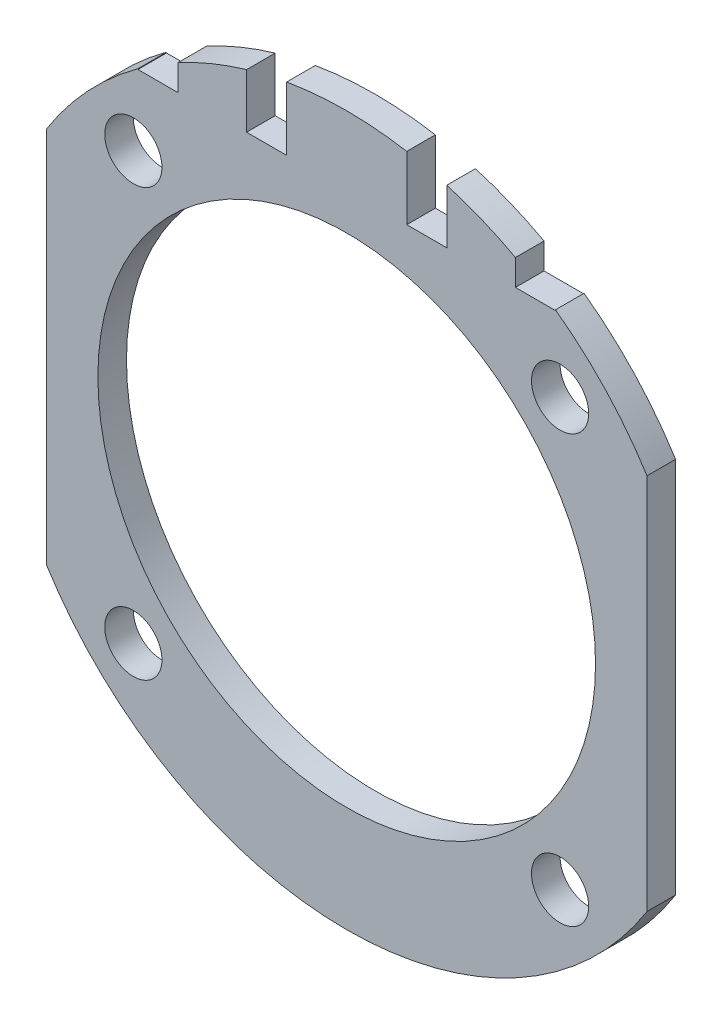
from build123d import *

# Parameters (mm, degrees)
SKETCH_1_R               = 124
SKETCH_1_R_2             = 87
SKETCH_1_R_3             = 10
EXTRUDE_1_DEPTH          = 5
CUT_EXTRUDE_1_DEPTH      = 176.64737402
CUT_EXTRUDE_1_DEPTH_BACK = 176.64737402
SKETCH_2_OUTSIDE_W       = 320.174
SKETCH_2_OUTSIDE_H       = 320.174
SKETCH_2_OUTSIDE_W_2     = 210
SKETCH_2_OUTSIDE_H_2     = 280
CUT_EXTRUDE_2_DEPTH      = 163.791277408
CUT_EXTRUDE_2_DEPTH_BACK = 163.791277408
SKETCH_3_W               = 14
SKETCH_3_H               = 48


with BuildPart() as part:
    # Эскиз1 → Бобышка-Вытянуть1 (new, symmetric)
    with BuildSketch(Plane.XY):
        Circle(SKETCH_1_R)
        Circle(SKETCH_1_R_2, mode=Mode.SUBTRACT)
        with Locations((74.599765415, 74.599765415)):
            Circle(SKETCH_1_R_3, mode=Mode.SUBTRACT)
        with Locations((74.599765415, -74.599765415)):
            Circle(SKETCH_1_R_3, mode=Mode.SUBTRACT)
        with Locations((-74.599765415, -74.599765415)):
            Circle(SKETCH_1_R_3, mode=Mode.SUBTRACT)
        with Locations((-74.599765415, 74.599765415)):
            Circle(SKETCH_1_R_3, mode=Mode.SUBTRACT)
    extrude(amount=EXTRUDE_1_DEPTH, both=True)

    # Эскиз2 outside → Вырез-Вытянуть1 (cut, two sides: drawn at the far end of the back side and taken through both)
    with BuildSketch(Plane.XY.offset(5).offset(-CUT_EXTRUDE_1_DEPTH_BACK)):
        Rectangle(SKETCH_2_OUTSIDE_W, SKETCH_2_OUTSIDE_H)
        Rectangle(SKETCH_2_OUTSIDE_W_2, SKETCH_2_OUTSIDE_H_2, mode=Mode.SUBTRACT)
    extrude(amount=CUT_EXTRUDE_1_DEPTH + CUT_EXTRUDE_1_DEPTH_BACK, mode=Mode.SUBTRACT)

    # Эскиз3 → Вырез-Вытянуть2 (cut, two sides: drawn at the far end of the back side and taken through both)
    with BuildSketch(Plane.XY.offset(5).offset(-CUT_EXTRUDE_2_DEPTH_BACK)):
        with Locations((-66, 124)):
            Rectangle(SKETCH_3_W, SKETCH_3_H)
        with Locations((66, 124)):
            Rectangle(SKETCH_3_W, SKETCH_3_H)
        with Locations((28, 124)):
            Rectangle(SKETCH_3_W, SKETCH_3_H)
        with Locations((-28, 124)):
            Rectangle(SKETCH_3_W, SKETCH_3_H)
    extrude(amount=CUT_EXTRUDE_2_DEPTH + CUT_EXTRUDE_2_DEPTH_BACK, mode=Mode.SUBTRACT)


solid = part.part
